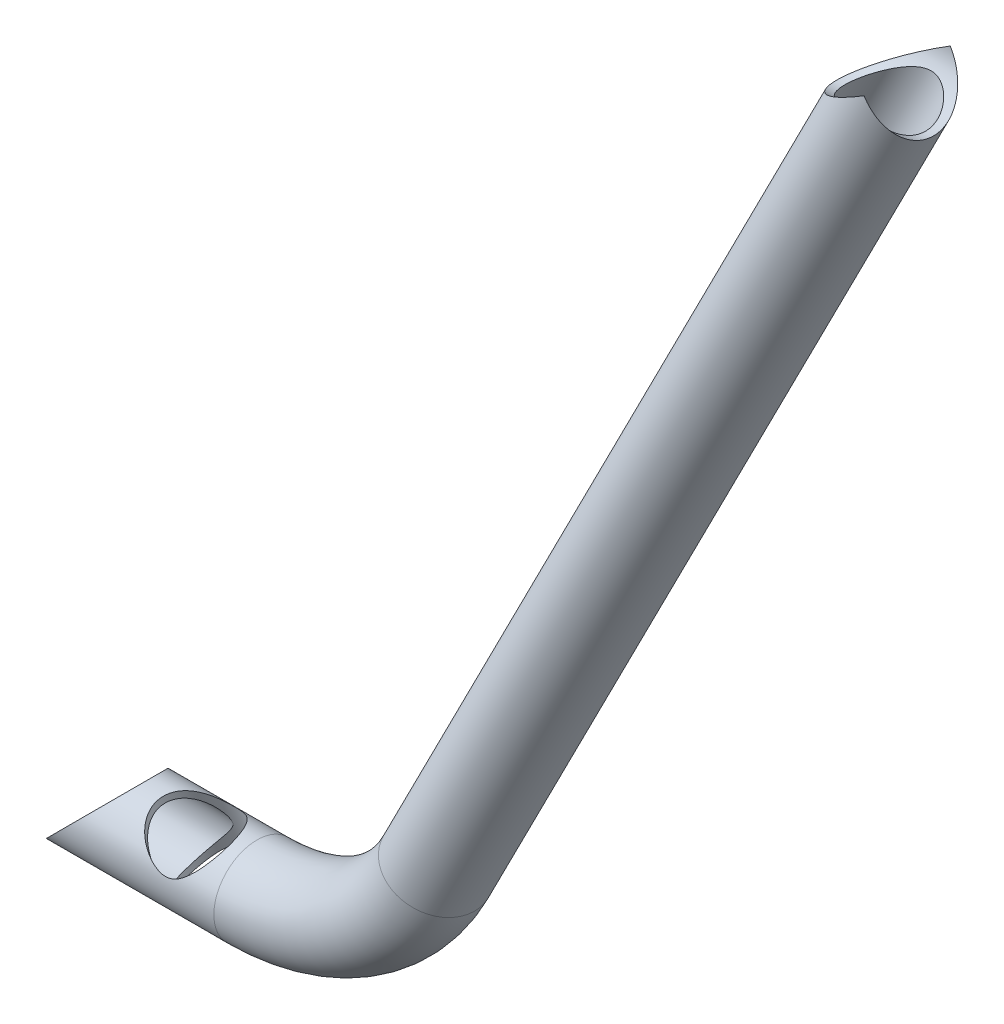
from build123d import *

# Parameters (mm, degrees)
SKETCH_2_R               = 15
SKETCH_3_R               = 12.5
CUT_EXTRUDE_1_DEPTH      = 477.393401595
CUT_EXTRUDE_1_DEPTH_BACK = 477.393401595
CUT_EXTRUDE_2_DEPTH      = 477.393401595
CUT_EXTRUDE_2_DEPTH_BACK = 477.393401595
SKETCH_8_R               = 12.88885
CUT_EXTRUDE_1048_DEPTH   = 464.426364673


with BuildPart() as part:
    # Sweep 1: sweep along a path in Эскиз1
    with BuildLine(Plane.XY) as sweep_1_path:
        Line((0, 0), (-163.954760295, -321.779334982))
        ThreePointArc((-163.954760295, -321.779334982), (-189.750317458, -349.684811505), (-226.325216988, -360))
        Line((-226.325216988, -360), (-293.429161818, -360))
    # Эскиз2 → Sweep 1 (sweep)
    with BuildSketch(Plane(origin=(-293.429161818, -360, 0), x_dir=(0, 0, 1), z_dir=(-1, 0, 0))):
        Circle(SKETCH_2_R)
    sweep(path=sweep_1_path.line)

    # Sweep 1 2: sweep along a path in Эскиз1<2>
    with BuildLine(Plane.XY) as sweep_1_2_path:
        Line((0, 0), (-163.954760295, -321.779334982))
        ThreePointArc((-163.954760295, -321.779334982), (-189.750317458, -349.684811505), (-226.325216988, -360))
        Line((-226.325216988, -360), (-293.429161818, -360))
    # Эскиз3 → Sweep 1 2 (sweep, cut)
    with BuildSketch(Plane.ZY.offset(293.429161818)):
        with Locations((0, -360)):
            Circle(SKETCH_3_R)
    sweep(path=sweep_1_2_path.line, mode=Mode.SUBTRACT)

    # Эскиз4 → Вырез-Вытянуть1 (cut, two sides: drawn at the far end of the back side and taken through both)
    with BuildSketch(Plane.XY.offset(-CUT_EXTRUDE_1_DEPTH_BACK)):
        Polygon((-263.429161818, -345), (-293.429161818, -375), (-293.429161818, -345), align=None)
    extrude(amount=CUT_EXTRUDE_1_DEPTH + CUT_EXTRUDE_1_DEPTH_BACK, mode=Mode.SUBTRACT)

    # Эскиз5 → Вырез-Вытянуть2 (cut, two sides: drawn at the far end of the back side and taken through both)
    with BuildSketch(Plane(origin=(0, 0, 0), x_dir=(0, 0, -1), z_dir=(1, 0, 0)).offset(-CUT_EXTRUDE_2_DEPTH_BACK)):
        with BuildLine():
            Line((-15, 0), (-15, 6.809857496))
            Line((-15, 6.809857496), (15, 6.809857496))
            Line((15, 6.809857496), (15, 0))
            ThreePointArc((15, 0), (0, -15), (-15, 0))
        make_face()
    extrude(amount=CUT_EXTRUDE_2_DEPTH + CUT_EXTRUDE_2_DEPTH_BACK, mode=Mode.SUBTRACT)

    # Эскиз8 → Cut-Extrude 1048 (cut, through all)
    with BuildSketch(Plane(origin=(0, -331.983389073, -120.832071893), x_dir=(1, 0, 0), z_dir=(0, -0.9396926207859081, -0.34202014332566943))):
        with Locations((-243.429161818, 123.127251597)):
            Circle(SKETCH_8_R)
    extrude(amount=-CUT_EXTRUDE_1048_DEPTH, mode=Mode.SUBTRACT)


solid = part.part
